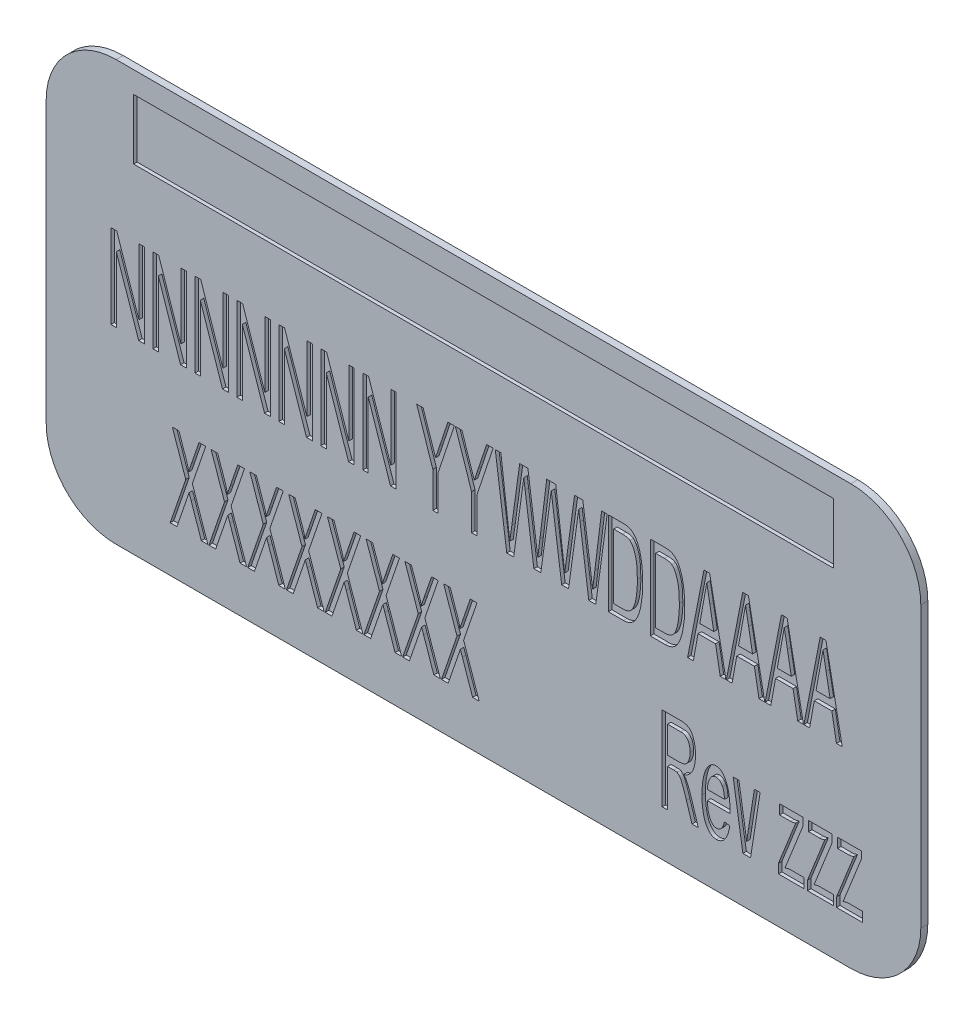
from build123d import *

# Parameters (mm, degrees)
BOSS_EXTRU_1_DEPTH      = 0.2
ENL_V_MAT_EXTRU_1_DEPTH = 0.1
ENL_V_MAT_EXTRU_2_DEPTH = 0.1
ESQUISSE10_W            = 20
ESQUISSE10_H            = 1.725075407
ENL_V_MAT_EXTRU_3_DEPTH = 0.1


with BuildPart() as part:
    # Esquisse1 → Boss.-Extru.1 (new body)
    with BuildSketch(Plane.XY):
        with BuildLine():
            Line((-21.848822837, 2.338176796), (-0.848822837, 2.338176796))
            ThreePointArc((-0.848822837, 2.338176796), (0.565390725, 1.752390358), (1.151177163, 0.338176796))
            Line((1.151177163, 0.338176796), (1.151177163, -7.661823204))
            ThreePointArc((1.151177163, -7.661823204), (0.565390725, -9.076036767), (-0.848822837, -9.661823204))
            Line((-0.848822837, -9.661823204), (-21.848822837, -9.661823204))
            ThreePointArc((-21.848822837, -9.661823204), (-23.263036399, -9.076036767), (-23.848822837, -7.661823204))
            Line((-23.848822837, -7.661823204), (-23.848822837, 0.338176796))
            ThreePointArc((-23.848822837, 0.338176796), (-23.263036399, 1.752390358), (-21.848822837, 2.338176796))
        make_face()
    extrude(amount=BOSS_EXTRU_1_DEPTH)

    # Esquisse2 → Enlèv. mat.-Extru.1 (cut)
    # profile 1 of 17: a face of its own
    with BuildSketch(Plane.XY.offset(0.2)):
        Polygon((-21.997375607, -4.2960697), (-21.997375607, -1.8960697), (-21.83295253, -1.8960697), (-21.197375607, -3.7773197), (-21.197375607, -1.8960697), (-21.043529453, -1.8960697), (-21.043529453, -4.2960697), (-21.20795253, -4.2960697), (-21.843529453, -2.415781238), (-21.843529453, -4.2960697), align=None)
    # profile 2 of 17: a face of its own
    with BuildSketch(Plane.XY.offset(0.2)):
        Polygon((-20.797375607, -4.2960697), (-20.797375607, -1.8960697), (-20.63295253, -1.8960697), (-19.997375607, -3.7773197), (-19.997375607, -1.8960697), (-19.843529453, -1.8960697), (-19.843529453, -4.2960697), (-20.00795253, -4.2960697), (-20.643529453, -2.415781238), (-20.643529453, -4.2960697), align=None)
    # profile 3 of 17: a face of its own
    with BuildSketch(Plane.XY.offset(0.2)):
        Polygon((-19.597375607, -4.2960697), (-19.597375607, -1.8960697), (-19.43295253, -1.8960697), (-18.797375607, -3.7773197), (-18.797375607, -1.8960697), (-18.643529453, -1.8960697), (-18.643529453, -4.2960697), (-18.80795253, -4.2960697), (-19.443529453, -2.415781238), (-19.443529453, -4.2960697), align=None)
    # profile 4 of 17: a face of its own
    with BuildSketch(Plane.XY.offset(0.2)):
        Polygon((-18.397375607, -4.2960697), (-18.397375607, -1.8960697), (-18.23295253, -1.8960697), (-17.597375607, -3.7773197), (-17.597375607, -1.8960697), (-17.443529453, -1.8960697), (-17.443529453, -4.2960697), (-17.60795253, -4.2960697), (-18.243529453, -2.415781238), (-18.243529453, -4.2960697), align=None)
    # profile 5 of 17: a face of its own
    with BuildSketch(Plane.XY.offset(0.2)):
        Polygon((-17.197375607, -4.2960697), (-17.197375607, -1.8960697), (-17.03295253, -1.8960697), (-16.397375607, -3.7773197), (-16.397375607, -1.8960697), (-16.243529453, -1.8960697), (-16.243529453, -4.2960697), (-16.40795253, -4.2960697), (-17.043529453, -2.415781238), (-17.043529453, -4.2960697), align=None)
    # profile 6 of 17: a face of its own
    with BuildSketch(Plane.XY.offset(0.2)):
        Polygon((-15.997375607, -4.2960697), (-15.997375607, -1.8960697), (-15.83295253, -1.8960697), (-15.197375607, -3.7773197), (-15.197375607, -1.8960697), (-15.043529453, -1.8960697), (-15.043529453, -4.2960697), (-15.20795253, -4.2960697), (-15.843529453, -2.415781238), (-15.843529453, -4.2960697), align=None)
    # profile 7 of 17: a face of its own
    with BuildSketch(Plane.XY.offset(0.2)):
        Polygon((-14.797375607, -4.2960697), (-14.797375607, -1.8960697), (-14.63295253, -1.8960697), (-13.997375607, -3.7773197), (-13.997375607, -1.8960697), (-13.843529453, -1.8960697), (-13.843529453, -4.2960697), (-14.00795253, -4.2960697), (-14.643529453, -2.415781238), (-14.643529453, -4.2960697), align=None)
    # profile 8 of 17: a face of its own
    with BuildSketch(Plane.XY.offset(0.2)):
        with BuildLine():
            Line((-12.797375607, -4.2960697), (-12.797375607, -3.279242777))
            Line((-12.797375607, -3.279242777), (-13.258914068, -1.8960697))
            Line((-13.258914068, -1.8960697), (-13.073817915, -1.8960697))
            Line((-13.073817915, -1.8960697), (-12.827664068, -2.634531238))
            add(Edge.make_bspline(
                [(-12.827664068, -2.634531238), (-12.817067101, -2.666255268), (-12.796997087, -2.726338659), (-12.768867352, -2.811567966), (-12.743009071, -2.886493789), (-12.727613049, -2.933392326), (-12.72045253, -2.955204315)],
                knots=[0, 0, 0, 0, 1.187045161, 2.248191592, 3.185253382, 4, 4, 4, 4], degree=3))
            add(Edge.make_bspline(
                [(-12.72045253, -2.955204315), (-12.717103326, -2.945102744), (-12.709974274, -2.923600726), (-12.698301361, -2.889564566), (-12.685939781, -2.85148447), (-12.672066077, -2.809793962), (-12.656454381, -2.764571995), (-12.640292101, -2.715417778), (-12.622425768, -2.662773253), (-12.610335281, -2.626365232), (-12.604106376, -2.607608161)],
                knots=[0, 0, 0, 0, 0.696802911, 1.483201767, 2.355870768, 3.318122407, 4.360029798, 5.488186892, 6.705937452, 8, 8, 8, 8], degree=3))
            Line((-12.604106376, -2.607608161), (-12.367087145, -1.8960697))
            Line((-12.367087145, -1.8960697), (-12.181990991, -1.8960697))
            Line((-12.181990991, -1.8960697), (-12.643529453, -3.279242777))
            Line((-12.643529453, -3.279242777), (-12.643529453, -4.2960697))
            Line((-12.643529453, -4.2960697), (-12.797375607, -4.2960697))
        make_face()
    # profile 9 of 17: a face of its own
    with BuildSketch(Plane.XY.offset(0.2)):
        with BuildLine():
            Line((-11.689683299, -4.2960697), (-11.689683299, -3.279242777))
            Line((-11.689683299, -3.279242777), (-12.151221761, -1.8960697))
            Line((-12.151221761, -1.8960697), (-11.966125607, -1.8960697))
            Line((-11.966125607, -1.8960697), (-11.719971761, -2.634531238))
            add(Edge.make_bspline(
                [(-11.719971761, -2.634531238), (-11.709374793, -2.666255268), (-11.68930478, -2.726338659), (-11.661175045, -2.811567966), (-11.635316764, -2.886493789), (-11.619920741, -2.933392326), (-11.612760222, -2.955204315)],
                knots=[0, 0, 0, 0, 1.187045161, 2.248191592, 3.185253382, 4, 4, 4, 4], degree=3))
            add(Edge.make_bspline(
                [(-11.612760222, -2.955204315), (-11.609411019, -2.945102744), (-11.602281966, -2.923600726), (-11.590609053, -2.889564566), (-11.578247473, -2.85148447), (-11.564373769, -2.809793962), (-11.548762073, -2.764571995), (-11.532599794, -2.715417778), (-11.51473346, -2.662773253), (-11.502642974, -2.626365232), (-11.496414068, -2.607608161)],
                knots=[0, 0, 0, 0, 0.696802911, 1.483201767, 2.355870768, 3.318122407, 4.360029798, 5.488186892, 6.705937452, 8, 8, 8, 8], degree=3))
            Line((-11.496414068, -2.607608161), (-11.259394838, -1.8960697))
            Line((-11.259394838, -1.8960697), (-11.074298684, -1.8960697))
            Line((-11.074298684, -1.8960697), (-11.535837145, -3.279242777))
            Line((-11.535837145, -3.279242777), (-11.535837145, -4.2960697))
            Line((-11.535837145, -4.2960697), (-11.689683299, -4.2960697))
        make_face()
    # profile 10 of 17: a face of its own
    with BuildSketch(Plane.XY.offset(0.2)):
        with BuildLine():
            Line((-10.684394838, -4.2960697), (-11.012760222, -1.8960697))
            Line((-11.012760222, -1.8960697), (-10.853144838, -1.8960697))
            Line((-10.853144838, -1.8960697), (-10.657471761, -3.473954315))
            add(Edge.make_bspline(
                [(-10.657471761, -3.473954315), (-10.64734577, -3.55520063), (-10.62713556, -3.717358111), (-10.607281913, -3.879559634), (-10.597375607, -3.960492777)],
                knots=[0, 0, 0, 0, 1.002066804, 2, 2, 2, 2], degree=3))
            add(Edge.make_bspline(
                [(-10.597375607, -3.960492777), (-10.59334946, -3.931008296), (-10.585757099, -3.875407539), (-10.575331413, -3.796839168), (-10.565567178, -3.728131758), (-10.557443171, -3.66915054), (-10.550742272, -3.620108005), (-10.545306797, -3.58102531), (-10.541670379, -3.551647588), (-10.53922511, -3.535329395), (-10.538240991, -3.528762007)],
                knots=[0, 0, 0, 0, 1.638949351, 3.090670897, 4.365107455, 5.461054644, 6.369771406, 7.091258957, 7.634269859, 8, 8, 8, 8], degree=3))
            Line((-10.538240991, -3.528762007), (-10.314683299, -1.8960697))
            Line((-10.314683299, -1.8960697), (-10.080067915, -1.8960697))
            Line((-10.080067915, -1.8960697), (-9.913721761, -3.110492777))
            add(Edge.make_bspline(
                [(-9.913721761, -3.110492777), (-9.903395012, -3.184201056), (-9.883014943, -3.329665999), (-9.854065415, -3.545146419), (-9.824841618, -3.754666571), (-9.806444072, -3.892535049), (-9.797375607, -3.960492777)],
                knots=[0, 0, 0, 0, 1.041039999, 2.054515778, 3.041037602, 4, 4, 4, 4], degree=3))
            add(Edge.make_bspline(
                [(-9.797375607, -3.960492777), (-9.792900857, -3.923792532), (-9.783539984, -3.847018114), (-9.768606492, -3.72666907), (-9.752165978, -3.596091717), (-9.741096244, -3.50552847), (-9.735356376, -3.4585697)],
                knots=[0, 0, 0, 0, 0.87725687, 1.835161778, 2.8774901, 4, 4, 4, 4], degree=3))
            Line((-9.735356376, -3.4585697), (-9.541606376, -1.8960697))
            Line((-9.541606376, -1.8960697), (-9.381990991, -1.8960697))
            Line((-9.381990991, -1.8960697), (-9.710356376, -4.2960697))
            Line((-9.710356376, -4.2960697), (-9.908433299, -4.2960697))
            Line((-9.908433299, -4.2960697), (-10.15795253, -2.474915854))
            add(Edge.make_bspline(
                [(-10.15795253, -2.474915854), (-10.160342745, -2.456805094), (-10.16489179, -2.422336787), (-10.171579216, -2.37329137), (-10.177935955, -2.329579239), (-10.183303599, -2.29096665), (-10.187492477, -2.257434043), (-10.191267169, -2.229057283), (-10.194833616, -2.205870674), (-10.196597195, -2.192066473), (-10.197375607, -2.185973546)],
                knots=[0, 0, 0, 0, 1.503406976, 2.861276566, 4.073641829, 5.138672782, 6.06948784, 6.854747432, 7.494505974, 8, 8, 8, 8], degree=3))
            add(Edge.make_bspline(
                [(-10.197375607, -2.185973546), (-10.201544917, -2.216101371), (-10.209439293, -2.273146869), (-10.220595945, -2.354063071), (-10.230051455, -2.42574122), (-10.236293275, -2.47043203), (-10.23920253, -2.491262007)],
                knots=[0, 0, 0, 0, 1.184456801, 2.242708451, 3.180942521, 4, 4, 4, 4], degree=3))
            Line((-10.23920253, -2.491262007), (-10.486798684, -4.2960697))
            Line((-10.486798684, -4.2960697), (-10.684394838, -4.2960697))
        make_face()
    # profile 11 of 17: a face of its own
    with BuildSketch(Plane.XY.offset(0.2)):
        with BuildLine():
            Line((-9.115164068, -4.2960697), (-9.443529453, -1.8960697))
            Line((-9.443529453, -1.8960697), (-9.283914068, -1.8960697))
            Line((-9.283914068, -1.8960697), (-9.088240991, -3.473954315))
            add(Edge.make_bspline(
                [(-9.088240991, -3.473954315), (-9.078115001, -3.55520063), (-9.057904791, -3.717358111), (-9.038051144, -3.879559634), (-9.028144838, -3.960492777)],
                knots=[0, 0, 0, 0, 1.002066804, 2, 2, 2, 2], degree=3))
            add(Edge.make_bspline(
                [(-9.028144838, -3.960492777), (-9.024118691, -3.931008296), (-9.016526329, -3.875407539), (-9.006100643, -3.796839168), (-8.996336409, -3.728131758), (-8.988212402, -3.66915054), (-8.981511503, -3.620108005), (-8.976076028, -3.58102531), (-8.972439609, -3.551647588), (-8.96999434, -3.535329395), (-8.969010222, -3.528762007)],
                knots=[0, 0, 0, 0, 1.638949351, 3.090670897, 4.365107455, 5.461054644, 6.369771406, 7.091258957, 7.634269859, 8, 8, 8, 8], degree=3))
            Line((-8.969010222, -3.528762007), (-8.74545253, -1.8960697))
            Line((-8.74545253, -1.8960697), (-8.510837145, -1.8960697))
            Line((-8.510837145, -1.8960697), (-8.344490991, -3.110492777))
            add(Edge.make_bspline(
                [(-8.344490991, -3.110492777), (-8.334164243, -3.184201056), (-8.313784174, -3.329665999), (-8.284834645, -3.545146419), (-8.255610849, -3.754666571), (-8.237213302, -3.892535049), (-8.228144838, -3.960492777)],
                knots=[0, 0, 0, 0, 1.041039999, 2.054515778, 3.041037602, 4, 4, 4, 4], degree=3))
            add(Edge.make_bspline(
                [(-8.228144838, -3.960492777), (-8.223670088, -3.923792532), (-8.214309215, -3.847018114), (-8.199375722, -3.72666907), (-8.182935208, -3.596091717), (-8.171865475, -3.50552847), (-8.166125607, -3.4585697)],
                knots=[0, 0, 0, 0, 0.87725687, 1.835161778, 2.8774901, 4, 4, 4, 4], degree=3))
            Line((-8.166125607, -3.4585697), (-7.972375607, -1.8960697))
            Line((-7.972375607, -1.8960697), (-7.812760222, -1.8960697))
            Line((-7.812760222, -1.8960697), (-8.141125607, -4.2960697))
            Line((-8.141125607, -4.2960697), (-8.33920253, -4.2960697))
            Line((-8.33920253, -4.2960697), (-8.588721761, -2.474915854))
            add(Edge.make_bspline(
                [(-8.588721761, -2.474915854), (-8.591111976, -2.456805094), (-8.595661021, -2.422336787), (-8.602348446, -2.37329137), (-8.608705186, -2.329579239), (-8.61407283, -2.29096665), (-8.618261708, -2.257434043), (-8.6220364, -2.229057283), (-8.625602847, -2.205870674), (-8.627366425, -2.192066473), (-8.628144838, -2.185973546)],
                knots=[0, 0, 0, 0, 1.503406976, 2.861276566, 4.073641829, 5.138672782, 6.06948784, 6.854747432, 7.494505974, 8, 8, 8, 8], degree=3))
            add(Edge.make_bspline(
                [(-8.628144838, -2.185973546), (-8.632314148, -2.216101371), (-8.640208523, -2.273146869), (-8.651365176, -2.354063071), (-8.660820686, -2.42574122), (-8.667062506, -2.47043203), (-8.669971761, -2.491262007)],
                knots=[0, 0, 0, 0, 1.184456801, 2.242708451, 3.180942521, 4, 4, 4, 4], degree=3))
            Line((-8.669971761, -2.491262007), (-8.917567915, -4.2960697))
            Line((-8.917567915, -4.2960697), (-9.115164068, -4.2960697))
        make_face()
    # profile 12 of 17: a face of its own
    with BuildSketch(Plane.XY.offset(0.2)):
        with BuildLine():
            Line((-7.781990991, -4.2960697), (-7.781990991, -1.8960697))
            Line((-7.781990991, -1.8960697), (-7.371894838, -1.8960697))
            add(Edge.make_bspline(
                [(-7.371894838, -1.8960697), (-7.350069147, -1.896272053), (-7.30902258, -1.89665261), (-7.25185344, -1.90372178), (-7.202192317, -1.913210612), (-7.173360356, -1.925116625), (-7.159875607, -1.930685084)],
                knots=[0, 0, 0, 0, 1.209218742, 2.274121739, 3.192804279, 4, 4, 4, 4], degree=3))
            add(Edge.make_bspline(
                [(-7.159875607, -1.930685084), (-7.1429887, -1.939553597), (-7.108524287, -1.957653304), (-7.062559089, -1.99699691), (-7.020469971, -2.04542114), (-6.997032248, -2.082886978), (-6.984875607, -2.1023197)],
                knots=[0, 0, 0, 0, 0.917248745, 1.872008839, 2.896256901, 4, 4, 4, 4], degree=3))
            add(Edge.make_bspline(
                [(-6.984875607, -2.1023197), (-6.969512609, -2.130712462), (-6.937663802, -2.189573081), (-6.900374035, -2.287459236), (-6.86834118, -2.395819561), (-6.842091141, -2.515043085), (-6.822557043, -2.644234502), (-6.80745918, -2.782469394), (-6.798962305, -2.92977629), (-6.797914749, -3.030995025), (-6.797375607, -3.08308893)],
                knots=[0, 0, 0, 0, 0.767236926, 1.590547629, 2.485512821, 3.453908061, 4.491812888, 5.592276963, 6.760825303, 8, 8, 8, 8], degree=3))
            add(Edge.make_bspline(
                [(-6.797375607, -3.08308893), (-6.797734491, -3.127325518), (-6.798431779, -3.213274234), (-6.804101816, -3.338375127), (-6.814120268, -3.455772153), (-6.828056545, -3.565114852), (-6.844761439, -3.665988029), (-6.863863141, -3.758098618), (-6.885292506, -3.841073982), (-6.908774243, -3.915291549), (-6.934587797, -3.980856525), (-6.960532503, -4.039332869), (-6.988754761, -4.090049996), (-7.017325855, -4.134479041), (-7.048962859, -4.172386037), (-7.082910352, -4.20529648), (-7.120528117, -4.23276087), (-7.160522679, -4.256351706), (-7.204212878, -4.273917856), (-7.250740589, -4.287094084), (-7.300480146, -4.294858602), (-7.334688136, -4.295659892), (-7.352183299, -4.2960697)],
                knots=[0, 0, 0, 0, 1.800094546, 3.497462691, 5.094565961, 6.593423588, 7.981807382, 9.254415828, 10.420159978, 11.4678544, 12.419732639, 13.286514356, 14.068783023, 14.77961528, 15.432569631, 16.073692928, 16.698454999, 17.323727399, 17.958316615, 18.608660443, 19.28842027, 20, 20, 20, 20], degree=3))
            Line((-7.352183299, -4.2960697), (-7.781990991, -4.2960697))
        make_face()
        with BuildLine():
            Line((-7.628144838, -4.019146623), (-7.369010222, -4.019146623))
            add(Edge.make_bspline(
                [(-7.369010222, -4.019146623), (-7.350070326, -4.018612707), (-7.31423792, -4.017602591), (-7.263549605, -4.009607202), (-7.219262298, -3.995742153), (-7.180760123, -3.976354059), (-7.148017238, -3.950779936), (-7.118601781, -3.921541031), (-7.092801506, -3.887480237), (-7.078956833, -3.862286232), (-7.071894838, -3.849435084)],
                knots=[0, 0, 0, 0, 1.249650705, 2.364215218, 3.374377069, 4.301504878, 5.192076899, 6.104488424, 7.03312322, 8, 8, 8, 8], degree=3))
            add(Edge.make_bspline(
                [(-7.071894838, -3.849435084), (-7.062507897, -3.82892486), (-7.042651381, -3.785538884), (-7.01994002, -3.713252216), (-6.999179296, -3.631927373), (-6.982119415, -3.540529515), (-6.968308134, -3.439296282), (-6.95846237, -3.327796821), (-6.952077435, -3.206240683), (-6.951514351, -3.121719502), (-6.951221761, -3.077800469)],
                knots=[0, 0, 0, 0, 0.687444329, 1.454174466, 2.306617836, 3.247115966, 4.288242282, 5.422094717, 6.6604647, 8, 8, 8, 8], degree=3))
            add(Edge.make_bspline(
                [(-6.951221761, -3.077800469), (-6.951396663, -3.047189318), (-6.951736478, -2.987715521), (-6.954632478, -2.901146476), (-6.959411483, -2.820031756), (-6.965782424, -2.744446197), (-6.975329987, -2.674467518), (-6.985306014, -2.609670497), (-6.998482148, -2.550557708), (-7.012925305, -2.496654269), (-7.028826796, -2.447614193), (-7.045580352, -2.402816981), (-7.063238842, -2.362278093), (-7.082187372, -2.326169336), (-7.101128545, -2.293725891), (-7.121394006, -2.26571803), (-7.142396901, -2.241686011), (-7.158097617, -2.228736664), (-7.165644838, -2.222512007)],
                knots=[0, 0, 0, 0, 1.624486671, 3.156182828, 4.595991041, 5.936527029, 7.180250294, 8.343530302, 9.414514798, 10.39240733, 11.304157138, 12.14925215, 12.929879803, 13.64881622, 14.312455318, 14.921477323, 15.481561996, 16, 16, 16, 16], degree=3))
            add(Edge.make_bspline(
                [(-7.165644838, -2.222512007), (-7.177703233, -2.214711662), (-7.203700334, -2.197894634), (-7.252244455, -2.183930835), (-7.309445517, -2.173946744), (-7.350999189, -2.173326305), (-7.373337145, -2.172992777)],
                knots=[0, 0, 0, 0, 0.790842195, 1.705003453, 2.766281536, 4, 4, 4, 4], degree=3))
            Line((-7.373337145, -2.172992777), (-7.628144838, -2.172992777))
            Line((-7.628144838, -2.172992777), (-7.628144838, -4.019146623))
        make_face(mode=Mode.SUBTRACT)
    # profile 13 of 17: a face of its own
    with BuildSketch(Plane.XY.offset(0.2)):
        with BuildLine():
            Line((-6.581990991, -4.2960697), (-6.581990991, -1.8960697))
            Line((-6.581990991, -1.8960697), (-6.171894838, -1.8960697))
            add(Edge.make_bspline(
                [(-6.171894838, -1.8960697), (-6.150069147, -1.896272053), (-6.10902258, -1.89665261), (-6.05185344, -1.90372178), (-6.002192317, -1.913210612), (-5.973360356, -1.925116625), (-5.959875607, -1.930685084)],
                knots=[0, 0, 0, 0, 1.209218742, 2.274121739, 3.192804279, 4, 4, 4, 4], degree=3))
            add(Edge.make_bspline(
                [(-5.959875607, -1.930685084), (-5.9429887, -1.939553597), (-5.908524287, -1.957653304), (-5.862559089, -1.99699691), (-5.820469971, -2.04542114), (-5.797032248, -2.082886978), (-5.784875607, -2.1023197)],
                knots=[0, 0, 0, 0, 0.917248745, 1.872008839, 2.896256901, 4, 4, 4, 4], degree=3))
            add(Edge.make_bspline(
                [(-5.784875607, -2.1023197), (-5.769512609, -2.130712462), (-5.737663802, -2.189573081), (-5.700374035, -2.287459236), (-5.66834118, -2.395819561), (-5.642091141, -2.515043085), (-5.622557043, -2.644234502), (-5.60745918, -2.782469394), (-5.598962305, -2.92977629), (-5.597914749, -3.030995025), (-5.597375607, -3.08308893)],
                knots=[0, 0, 0, 0, 0.767236926, 1.590547629, 2.485512821, 3.453908061, 4.491812888, 5.592276963, 6.760825303, 8, 8, 8, 8], degree=3))
            add(Edge.make_bspline(
                [(-5.597375607, -3.08308893), (-5.597734491, -3.127325518), (-5.598431779, -3.213274234), (-5.604101816, -3.338375127), (-5.614120268, -3.455772153), (-5.628056545, -3.565114852), (-5.644761439, -3.665988029), (-5.663863141, -3.758098618), (-5.685292506, -3.841073982), (-5.708774243, -3.915291549), (-5.734587797, -3.980856525), (-5.760532503, -4.039332869), (-5.788754761, -4.090049996), (-5.817325855, -4.134479041), (-5.848962859, -4.172386037), (-5.882910352, -4.20529648), (-5.920528117, -4.23276087), (-5.960522679, -4.256351706), (-6.004212878, -4.273917856), (-6.050740589, -4.287094084), (-6.100480146, -4.294858602), (-6.134688136, -4.295659892), (-6.152183299, -4.2960697)],
                knots=[0, 0, 0, 0, 1.800094546, 3.497462691, 5.094565961, 6.593423588, 7.981807382, 9.254415828, 10.420159978, 11.4678544, 12.419732639, 13.286514356, 14.068783023, 14.77961528, 15.432569631, 16.073692928, 16.698454999, 17.323727399, 17.958316615, 18.608660443, 19.28842027, 20, 20, 20, 20], degree=3))
            Line((-6.152183299, -4.2960697), (-6.581990991, -4.2960697))
        make_face()
        with BuildLine():
            Line((-6.428144838, -4.019146623), (-6.169010222, -4.019146623))
            add(Edge.make_bspline(
                [(-6.169010222, -4.019146623), (-6.150070326, -4.018612707), (-6.11423792, -4.017602591), (-6.063549605, -4.009607202), (-6.019262298, -3.995742153), (-5.980760123, -3.976354059), (-5.948017238, -3.950779936), (-5.918601781, -3.921541031), (-5.892801506, -3.887480237), (-5.878956833, -3.862286232), (-5.871894838, -3.849435084)],
                knots=[0, 0, 0, 0, 1.249650705, 2.364215218, 3.374377069, 4.301504878, 5.192076899, 6.104488424, 7.03312322, 8, 8, 8, 8], degree=3))
            add(Edge.make_bspline(
                [(-5.871894838, -3.849435084), (-5.862507897, -3.82892486), (-5.842651381, -3.785538884), (-5.81994002, -3.713252216), (-5.799179296, -3.631927373), (-5.782119415, -3.540529515), (-5.768308134, -3.439296282), (-5.75846237, -3.327796821), (-5.752077435, -3.206240683), (-5.751514351, -3.121719502), (-5.751221761, -3.077800469)],
                knots=[0, 0, 0, 0, 0.687444329, 1.454174466, 2.306617836, 3.247115966, 4.288242282, 5.422094717, 6.6604647, 8, 8, 8, 8], degree=3))
            add(Edge.make_bspline(
                [(-5.751221761, -3.077800469), (-5.751396663, -3.047189318), (-5.751736478, -2.987715521), (-5.754632478, -2.901146476), (-5.759411483, -2.820031756), (-5.765782424, -2.744446197), (-5.775329987, -2.674467518), (-5.785306014, -2.609670497), (-5.798482148, -2.550557708), (-5.812925305, -2.496654269), (-5.828826796, -2.447614193), (-5.845580352, -2.402816981), (-5.863238842, -2.362278093), (-5.882187372, -2.326169336), (-5.901128545, -2.293725891), (-5.921394006, -2.26571803), (-5.942396901, -2.241686011), (-5.958097617, -2.228736664), (-5.965644838, -2.222512007)],
                knots=[0, 0, 0, 0, 1.624486671, 3.156182828, 4.595991041, 5.936527029, 7.180250294, 8.343530302, 9.414514798, 10.39240733, 11.304157138, 12.14925215, 12.929879803, 13.64881622, 14.312455318, 14.921477323, 15.481561996, 16, 16, 16, 16], degree=3))
            add(Edge.make_bspline(
                [(-5.965644838, -2.222512007), (-5.977703233, -2.214711662), (-6.003700334, -2.197894634), (-6.052244455, -2.183930835), (-6.109445517, -2.173946744), (-6.150999189, -2.173326305), (-6.173337145, -2.172992777)],
                knots=[0, 0, 0, 0, 0.790842195, 1.705003453, 2.766281536, 4, 4, 4, 4], degree=3))
            Line((-6.173337145, -2.172992777), (-6.428144838, -2.172992777))
            Line((-6.428144838, -2.172992777), (-6.428144838, -4.019146623))
        make_face(mode=Mode.SUBTRACT)
    # profile 14 of 17: a face of its own
    with BuildSketch(Plane.XY.offset(0.2)):
        Polygon((-5.514683299, -4.2960697), (-5.048337145, -1.8960697), (-4.884875607, -1.8960697), (-4.418529453, -4.2960697), (-4.581990991, -4.2960697), (-4.715644838, -3.557608161), (-5.217087145, -3.557608161), (-5.351221761, -4.2960697), align=None)
        with BuildLine():
            Line((-5.167087145, -3.280685084), (-4.766125607, -3.280685084))
            Line((-4.766125607, -3.280685084), (-4.878625607, -2.659531238))
            add(Edge.make_bspline(
                [(-4.878625607, -2.659531238), (-4.883146751, -2.63501815), (-4.891949862, -2.587288759), (-4.904237011, -2.517509795), (-4.916598193, -2.451414092), (-4.927291481, -2.388820304), (-4.938108839, -2.329728617), (-4.948017641, -2.274245704), (-4.957796779, -2.222381837), (-4.963747036, -2.189023033), (-4.966606376, -2.172992777)],
                knots=[0, 0, 0, 0, 1.209945762, 2.355883214, 3.439198162, 4.473827899, 5.438166865, 6.355192696, 7.209603446, 8, 8, 8, 8], degree=3))
            add(Edge.make_bspline(
                [(-4.966606376, -2.172992777), (-4.979872677, -2.246877314), (-5.006582583, -2.395633853), (-5.03371789, -2.544313382), (-5.047375607, -2.619146623)],
                knots=[0, 0, 0, 0, 0.993361883, 2, 2, 2, 2], degree=3))
            Line((-5.047375607, -2.619146623), (-5.167087145, -3.280685084))
        make_face(mode=Mode.SUBTRACT)
    # profile 15 of 17: a face of its own
    with BuildSketch(Plane.XY.offset(0.2)):
        Polygon((-4.406990991, -4.2960697), (-3.940644838, -1.8960697), (-3.777183299, -1.8960697), (-3.310837145, -4.2960697), (-3.474298684, -4.2960697), (-3.60795253, -3.557608161), (-4.109394838, -3.557608161), (-4.243529453, -4.2960697), align=None)
        with BuildLine():
            Line((-4.059394838, -3.280685084), (-3.658433299, -3.280685084))
            Line((-3.658433299, -3.280685084), (-3.770933299, -2.659531238))
            add(Edge.make_bspline(
                [(-3.770933299, -2.659531238), (-3.775454443, -2.63501815), (-3.784257555, -2.587288759), (-3.796544703, -2.517509795), (-3.808905885, -2.451414092), (-3.819599173, -2.388820304), (-3.830416532, -2.329728617), (-3.840325334, -2.274245704), (-3.850104472, -2.222381837), (-3.856054729, -2.189023033), (-3.858914068, -2.172992777)],
                knots=[0, 0, 0, 0, 1.209945762, 2.355883214, 3.439198162, 4.473827899, 5.438166865, 6.355192696, 7.209603446, 8, 8, 8, 8], degree=3))
            add(Edge.make_bspline(
                [(-3.858914068, -2.172992777), (-3.872180369, -2.246877314), (-3.898890275, -2.395633853), (-3.926025582, -2.544313382), (-3.939683299, -2.619146623)],
                knots=[0, 0, 0, 0, 0.993361883, 2, 2, 2, 2], degree=3))
            Line((-3.939683299, -2.619146623), (-4.059394838, -3.280685084))
        make_face(mode=Mode.SUBTRACT)
    # profile 16 of 17: a face of its own
    with BuildSketch(Plane.XY.offset(0.2)):
        Polygon((-3.299298684, -4.2960697), (-2.83295253, -1.8960697), (-2.669490991, -1.8960697), (-2.203144838, -4.2960697), (-2.366606376, -4.2960697), (-2.500260222, -3.557608161), (-3.00170253, -3.557608161), (-3.135837145, -4.2960697), align=None)
        with BuildLine():
            Line((-2.95170253, -3.280685084), (-2.550740991, -3.280685084))
            Line((-2.550740991, -3.280685084), (-2.663240991, -2.659531238))
            add(Edge.make_bspline(
                [(-2.663240991, -2.659531238), (-2.667762136, -2.63501815), (-2.676565247, -2.587288759), (-2.688852395, -2.517509795), (-2.701213578, -2.451414092), (-2.711906865, -2.388820304), (-2.722724224, -2.329728617), (-2.732633026, -2.274245704), (-2.742412164, -2.222381837), (-2.748362421, -2.189023033), (-2.751221761, -2.172992777)],
                knots=[0, 0, 0, 0, 1.209945762, 2.355883214, 3.439198162, 4.473827899, 5.438166865, 6.355192696, 7.209603446, 8, 8, 8, 8], degree=3))
            add(Edge.make_bspline(
                [(-2.751221761, -2.172992777), (-2.764488062, -2.246877314), (-2.791197967, -2.395633853), (-2.818333274, -2.544313382), (-2.831990991, -2.619146623)],
                knots=[0, 0, 0, 0, 0.993361883, 2, 2, 2, 2], degree=3))
            Line((-2.831990991, -2.619146623), (-2.95170253, -3.280685084))
        make_face(mode=Mode.SUBTRACT)
    # profile 17 of 17: a face of its own
    with BuildSketch(Plane.XY.offset(0.2)):
        Polygon((-2.191606376, -4.2960697), (-1.725260222, -1.8960697), (-1.561798684, -1.8960697), (-1.09545253, -4.2960697), (-1.258914068, -4.2960697), (-1.392567915, -3.557608161), (-1.894010222, -3.557608161), (-2.028144838, -4.2960697), align=None)
        with BuildLine():
            Line((-1.844010222, -3.280685084), (-1.443048684, -3.280685084))
            Line((-1.443048684, -3.280685084), (-1.555548684, -2.659531238))
            add(Edge.make_bspline(
                [(-1.555548684, -2.659531238), (-1.560069828, -2.63501815), (-1.568872939, -2.587288759), (-1.581160088, -2.517509795), (-1.59352127, -2.451414092), (-1.604214558, -2.388820304), (-1.615031916, -2.329728617), (-1.624940718, -2.274245704), (-1.634719856, -2.222381837), (-1.640670113, -2.189023033), (-1.643529453, -2.172992777)],
                knots=[0, 0, 0, 0, 1.209945762, 2.355883214, 3.439198162, 4.473827899, 5.438166865, 6.355192696, 7.209603446, 8, 8, 8, 8], degree=3))
            add(Edge.make_bspline(
                [(-1.643529453, -2.172992777), (-1.656795754, -2.246877314), (-1.68350566, -2.395633853), (-1.710640967, -2.544313382), (-1.724298684, -2.619146623)],
                knots=[0, 0, 0, 0, 0.993361883, 2, 2, 2, 2], degree=3))
            Line((-1.724298684, -2.619146623), (-1.844010222, -3.280685084))
        make_face(mode=Mode.SUBTRACT)
    extrude(amount=-ENL_V_MAT_EXTRU_1_DEPTH, mode=Mode.SUBTRACT)

    # Esquisse8 → Enlèv. mat.-Extru.2 (cut)
    # profile 1 of 14: a face of its own
    with BuildSketch(Plane.XY.offset(0.2)):
        with BuildLine():
            Line((-20.304250109, -8.356300295), (-19.860500109, -7.063511833))
            Line((-19.860500109, -7.063511833), (-20.242711648, -5.956300295))
            Line((-20.242711648, -5.956300295), (-20.055211648, -5.956300295))
            Line((-20.055211648, -5.956300295), (-19.837423186, -6.587069525))
            add(Edge.make_bspline(
                [(-19.837423186, -6.587069525), (-19.832433738, -6.60228607), (-19.82289605, -6.63137359), (-19.809613489, -6.673030679), (-19.799598971, -6.711108998), (-19.791746444, -6.745241203), (-19.786462029, -6.775409745), (-19.78316076, -6.801720566), (-19.783068459, -6.824319305), (-19.784739943, -6.838040751), (-19.785500109, -6.844281064)],
                knots=[0, 0, 0, 0, 1.453428248, 2.778332613, 3.967248284, 5.025801759, 5.955965637, 6.746200148, 7.429790105, 8, 8, 8, 8], degree=3))
            add(Edge.make_bspline(
                [(-19.785500109, -6.844281064), (-19.778879034, -6.825388158), (-19.765151268, -6.786216672), (-19.744858883, -6.725078534), (-19.721863247, -6.660046763), (-19.706455789, -6.615127472), (-19.698480879, -6.591877218)],
                knots=[0, 0, 0, 0, 0.899792049, 1.865578155, 2.895221838, 4, 4, 4, 4], degree=3))
            Line((-19.698480879, -6.591877218), (-19.480692417, -5.956300295))
            Line((-19.480692417, -5.956300295), (-19.288865494, -5.956300295))
            Line((-19.288865494, -5.956300295), (-19.671077033, -7.070242602))
            Line((-19.671077033, -7.070242602), (-19.227327033, -8.356300295))
            Line((-19.227327033, -8.356300295), (-19.414827033, -8.356300295))
            Line((-19.414827033, -8.356300295), (-19.706173186, -7.509665679))
            add(Edge.make_bspline(
                [(-19.706173186, -7.509665679), (-19.715326934, -7.483390245), (-19.734851235, -7.42734659), (-19.75411441, -7.371212633), (-19.764346263, -7.341396449)],
                knots=[0, 0, 0, 0, 0.937677431, 2, 2, 2, 2], degree=3))
            add(Edge.make_bspline(
                [(-19.764346263, -7.341396449), (-19.771285038, -7.361572474), (-19.783942824, -7.398377791), (-19.800533609, -7.448728435), (-19.81462384, -7.488310979), (-19.822536082, -7.511422721), (-19.825884725, -7.521204141)],
                knots=[0, 0, 0, 0, 1.347179553, 2.45753912, 3.347195111, 4, 4, 4, 4], degree=3))
            Line((-19.825884725, -7.521204141), (-20.112423186, -8.356300295))
            Line((-20.112423186, -8.356300295), (-20.304250109, -8.356300295))
        make_face()
    # profile 2 of 14: a face of its own
    with BuildSketch(Plane.XY.offset(0.2)):
        with BuildLine():
            Line((-19.196557802, -8.356300295), (-18.752807802, -7.063511833))
            Line((-18.752807802, -7.063511833), (-19.13501934, -5.956300295))
            Line((-19.13501934, -5.956300295), (-18.94751934, -5.956300295))
            Line((-18.94751934, -5.956300295), (-18.729730879, -6.587069525))
            add(Edge.make_bspline(
                [(-18.729730879, -6.587069525), (-18.724741431, -6.60228607), (-18.715203742, -6.63137359), (-18.701921182, -6.673030679), (-18.691906664, -6.711108998), (-18.684054137, -6.745241203), (-18.678769721, -6.775409745), (-18.675468452, -6.801720566), (-18.675376151, -6.824319305), (-18.677047635, -6.838040751), (-18.677807802, -6.844281064)],
                knots=[0, 0, 0, 0, 1.453428248, 2.778332613, 3.967248284, 5.025801759, 5.955965637, 6.746200148, 7.429790105, 8, 8, 8, 8], degree=3))
            add(Edge.make_bspline(
                [(-18.677807802, -6.844281064), (-18.671186726, -6.825388158), (-18.65745896, -6.786216672), (-18.637166575, -6.725078534), (-18.614170939, -6.660046763), (-18.598763481, -6.615127472), (-18.590788571, -6.591877218)],
                knots=[0, 0, 0, 0, 0.899792049, 1.865578155, 2.895221838, 4, 4, 4, 4], degree=3))
            Line((-18.590788571, -6.591877218), (-18.373000109, -5.956300295))
            Line((-18.373000109, -5.956300295), (-18.181173186, -5.956300295))
            Line((-18.181173186, -5.956300295), (-18.563384725, -7.070242602))
            Line((-18.563384725, -7.070242602), (-18.119634725, -8.356300295))
            Line((-18.119634725, -8.356300295), (-18.307134725, -8.356300295))
            Line((-18.307134725, -8.356300295), (-18.598480879, -7.509665679))
            add(Edge.make_bspline(
                [(-18.598480879, -7.509665679), (-18.607634627, -7.483390245), (-18.627158927, -7.42734659), (-18.646422103, -7.371212633), (-18.656653956, -7.341396449)],
                knots=[0, 0, 0, 0, 0.937677431, 2, 2, 2, 2], degree=3))
            add(Edge.make_bspline(
                [(-18.656653956, -7.341396449), (-18.66359273, -7.361572474), (-18.676250516, -7.398377791), (-18.692841302, -7.448728435), (-18.706931533, -7.488310979), (-18.714843775, -7.511422721), (-18.718192417, -7.521204141)],
                knots=[0, 0, 0, 0, 1.347179553, 2.45753912, 3.347195111, 4, 4, 4, 4], degree=3))
            Line((-18.718192417, -7.521204141), (-19.004730879, -8.356300295))
            Line((-19.004730879, -8.356300295), (-19.196557802, -8.356300295))
        make_face()
    # profile 3 of 14: a face of its own
    with BuildSketch(Plane.XY.offset(0.2)):
        with BuildLine():
            Line((-18.088865494, -8.356300295), (-17.645115494, -7.063511833))
            Line((-17.645115494, -7.063511833), (-18.027327033, -5.956300295))
            Line((-18.027327033, -5.956300295), (-17.839827033, -5.956300295))
            Line((-17.839827033, -5.956300295), (-17.622038571, -6.587069525))
            add(Edge.make_bspline(
                [(-17.622038571, -6.587069525), (-17.617049123, -6.60228607), (-17.607511434, -6.63137359), (-17.594228874, -6.673030679), (-17.584214356, -6.711108998), (-17.576361829, -6.745241203), (-17.571077413, -6.775409745), (-17.567776144, -6.801720566), (-17.567683844, -6.824319305), (-17.569355327, -6.838040751), (-17.570115494, -6.844281064)],
                knots=[0, 0, 0, 0, 1.453428248, 2.778332613, 3.967248284, 5.025801759, 5.955965637, 6.746200148, 7.429790105, 8, 8, 8, 8], degree=3))
            add(Edge.make_bspline(
                [(-17.570115494, -6.844281064), (-17.563494418, -6.825388158), (-17.549766653, -6.786216672), (-17.529474268, -6.725078534), (-17.506478632, -6.660046763), (-17.491071174, -6.615127472), (-17.483096263, -6.591877218)],
                knots=[0, 0, 0, 0, 0.899792049, 1.865578155, 2.895221838, 4, 4, 4, 4], degree=3))
            Line((-17.483096263, -6.591877218), (-17.265307802, -5.956300295))
            Line((-17.265307802, -5.956300295), (-17.073480879, -5.956300295))
            Line((-17.073480879, -5.956300295), (-17.455692417, -7.070242602))
            Line((-17.455692417, -7.070242602), (-17.011942417, -8.356300295))
            Line((-17.011942417, -8.356300295), (-17.199442417, -8.356300295))
            Line((-17.199442417, -8.356300295), (-17.490788571, -7.509665679))
            add(Edge.make_bspline(
                [(-17.490788571, -7.509665679), (-17.499942319, -7.483390245), (-17.51946662, -7.42734659), (-17.538729795, -7.371212633), (-17.548961648, -7.341396449)],
                knots=[0, 0, 0, 0, 0.937677431, 2, 2, 2, 2], degree=3))
            add(Edge.make_bspline(
                [(-17.548961648, -7.341396449), (-17.555900423, -7.361572474), (-17.568558208, -7.398377791), (-17.585148994, -7.448728435), (-17.599239225, -7.488310979), (-17.607151467, -7.511422721), (-17.610500109, -7.521204141)],
                knots=[0, 0, 0, 0, 1.347179553, 2.45753912, 3.347195111, 4, 4, 4, 4], degree=3))
            Line((-17.610500109, -7.521204141), (-17.897038571, -8.356300295))
            Line((-17.897038571, -8.356300295), (-18.088865494, -8.356300295))
        make_face()
    # profile 4 of 14: a face of its own
    with BuildSketch(Plane.XY.offset(0.2)):
        with BuildLine():
            Line((-16.981173186, -8.356300295), (-16.537423186, -7.063511833))
            Line((-16.537423186, -7.063511833), (-16.919634725, -5.956300295))
            Line((-16.919634725, -5.956300295), (-16.732134725, -5.956300295))
            Line((-16.732134725, -5.956300295), (-16.514346263, -6.587069525))
            add(Edge.make_bspline(
                [(-16.514346263, -6.587069525), (-16.509356815, -6.60228607), (-16.499819127, -6.63137359), (-16.486536566, -6.673030679), (-16.476522048, -6.711108998), (-16.468669521, -6.745241203), (-16.463385106, -6.775409745), (-16.460083837, -6.801720566), (-16.459991536, -6.824319305), (-16.46166302, -6.838040751), (-16.462423186, -6.844281064)],
                knots=[0, 0, 0, 0, 1.453428248, 2.778332613, 3.967248284, 5.025801759, 5.955965637, 6.746200148, 7.429790105, 8, 8, 8, 8], degree=3))
            add(Edge.make_bspline(
                [(-16.462423186, -6.844281064), (-16.455802111, -6.825388158), (-16.442074345, -6.786216672), (-16.42178196, -6.725078534), (-16.398786324, -6.660046763), (-16.383378866, -6.615127472), (-16.375403956, -6.591877218)],
                knots=[0, 0, 0, 0, 0.899792049, 1.865578155, 2.895221838, 4, 4, 4, 4], degree=3))
            Line((-16.375403956, -6.591877218), (-16.157615494, -5.956300295))
            Line((-16.157615494, -5.956300295), (-15.965788571, -5.956300295))
            Line((-15.965788571, -5.956300295), (-16.348000109, -7.070242602))
            Line((-16.348000109, -7.070242602), (-15.904250109, -8.356300295))
            Line((-15.904250109, -8.356300295), (-16.091750109, -8.356300295))
            Line((-16.091750109, -8.356300295), (-16.383096263, -7.509665679))
            add(Edge.make_bspline(
                [(-16.383096263, -7.509665679), (-16.392250011, -7.483390245), (-16.411774312, -7.42734659), (-16.431037487, -7.371212633), (-16.44126934, -7.341396449)],
                knots=[0, 0, 0, 0, 0.937677431, 2, 2, 2, 2], degree=3))
            add(Edge.make_bspline(
                [(-16.44126934, -7.341396449), (-16.448208115, -7.361572474), (-16.460865901, -7.398377791), (-16.477456686, -7.448728435), (-16.491546917, -7.488310979), (-16.499459159, -7.511422721), (-16.502807802, -7.521204141)],
                knots=[0, 0, 0, 0, 1.347179553, 2.45753912, 3.347195111, 4, 4, 4, 4], degree=3))
            Line((-16.502807802, -7.521204141), (-16.789346263, -8.356300295))
            Line((-16.789346263, -8.356300295), (-16.981173186, -8.356300295))
        make_face()
    # profile 5 of 14: a face of its own
    with BuildSketch(Plane.XY.offset(0.2)):
        with BuildLine():
            Line((-15.873480879, -8.356300295), (-15.429730879, -7.063511833))
            Line((-15.429730879, -7.063511833), (-15.811942417, -5.956300295))
            Line((-15.811942417, -5.956300295), (-15.624442417, -5.956300295))
            Line((-15.624442417, -5.956300295), (-15.406653956, -6.587069525))
            add(Edge.make_bspline(
                [(-15.406653956, -6.587069525), (-15.401664508, -6.60228607), (-15.392126819, -6.63137359), (-15.378844259, -6.673030679), (-15.368829741, -6.711108998), (-15.360977213, -6.745241203), (-15.355692798, -6.775409745), (-15.352391529, -6.801720566), (-15.352299228, -6.824319305), (-15.353970712, -6.838040751), (-15.354730879, -6.844281064)],
                knots=[0, 0, 0, 0, 1.453428248, 2.778332613, 3.967248284, 5.025801759, 5.955965637, 6.746200148, 7.429790105, 8, 8, 8, 8], degree=3))
            add(Edge.make_bspline(
                [(-15.354730879, -6.844281064), (-15.348109803, -6.825388158), (-15.334382037, -6.786216672), (-15.314089652, -6.725078534), (-15.291094016, -6.660046763), (-15.275686558, -6.615127472), (-15.267711648, -6.591877218)],
                knots=[0, 0, 0, 0, 0.899792049, 1.865578155, 2.895221838, 4, 4, 4, 4], degree=3))
            Line((-15.267711648, -6.591877218), (-15.049923186, -5.956300295))
            Line((-15.049923186, -5.956300295), (-14.858096263, -5.956300295))
            Line((-14.858096263, -5.956300295), (-15.240307802, -7.070242602))
            Line((-15.240307802, -7.070242602), (-14.796557802, -8.356300295))
            Line((-14.796557802, -8.356300295), (-14.984057802, -8.356300295))
            Line((-14.984057802, -8.356300295), (-15.275403956, -7.509665679))
            add(Edge.make_bspline(
                [(-15.275403956, -7.509665679), (-15.284557704, -7.483390245), (-15.304082004, -7.42734659), (-15.32334518, -7.371212633), (-15.333577033, -7.341396449)],
                knots=[0, 0, 0, 0, 0.937677431, 2, 2, 2, 2], degree=3))
            add(Edge.make_bspline(
                [(-15.333577033, -7.341396449), (-15.340515807, -7.361572474), (-15.353173593, -7.398377791), (-15.369764379, -7.448728435), (-15.38385461, -7.488310979), (-15.391766851, -7.511422721), (-15.395115494, -7.521204141)],
                knots=[0, 0, 0, 0, 1.347179553, 2.45753912, 3.347195111, 4, 4, 4, 4], degree=3))
            Line((-15.395115494, -7.521204141), (-15.681653956, -8.356300295))
            Line((-15.681653956, -8.356300295), (-15.873480879, -8.356300295))
        make_face()
    # profile 6 of 14: a face of its own
    with BuildSketch(Plane.XY.offset(0.2)):
        with BuildLine():
            Line((-14.765788571, -8.356300295), (-14.322038571, -7.063511833))
            Line((-14.322038571, -7.063511833), (-14.704250109, -5.956300295))
            Line((-14.704250109, -5.956300295), (-14.516750109, -5.956300295))
            Line((-14.516750109, -5.956300295), (-14.298961648, -6.587069525))
            add(Edge.make_bspline(
                [(-14.298961648, -6.587069525), (-14.2939722, -6.60228607), (-14.284434511, -6.63137359), (-14.271151951, -6.673030679), (-14.261137433, -6.711108998), (-14.253284906, -6.745241203), (-14.24800049, -6.775409745), (-14.244699221, -6.801720566), (-14.24460692, -6.824319305), (-14.246278404, -6.838040751), (-14.247038571, -6.844281064)],
                knots=[0, 0, 0, 0, 1.453428248, 2.778332613, 3.967248284, 5.025801759, 5.955965637, 6.746200148, 7.429790105, 8, 8, 8, 8], degree=3))
            add(Edge.make_bspline(
                [(-14.247038571, -6.844281064), (-14.240417495, -6.825388158), (-14.22668973, -6.786216672), (-14.206397345, -6.725078534), (-14.183401709, -6.660046763), (-14.167994251, -6.615127472), (-14.16001934, -6.591877218)],
                knots=[0, 0, 0, 0, 0.899792049, 1.865578155, 2.895221838, 4, 4, 4, 4], degree=3))
            Line((-14.16001934, -6.591877218), (-13.942230879, -5.956300295))
            Line((-13.942230879, -5.956300295), (-13.750403956, -5.956300295))
            Line((-13.750403956, -5.956300295), (-14.132615494, -7.070242602))
            Line((-14.132615494, -7.070242602), (-13.688865494, -8.356300295))
            Line((-13.688865494, -8.356300295), (-13.876365494, -8.356300295))
            Line((-13.876365494, -8.356300295), (-14.167711648, -7.509665679))
            add(Edge.make_bspline(
                [(-14.167711648, -7.509665679), (-14.176865396, -7.483390245), (-14.196389696, -7.42734659), (-14.215652872, -7.371212633), (-14.225884725, -7.341396449)],
                knots=[0, 0, 0, 0, 0.937677431, 2, 2, 2, 2], degree=3))
            add(Edge.make_bspline(
                [(-14.225884725, -7.341396449), (-14.2328235, -7.361572474), (-14.245481285, -7.398377791), (-14.262072071, -7.448728435), (-14.276162302, -7.488310979), (-14.284074544, -7.511422721), (-14.287423186, -7.521204141)],
                knots=[0, 0, 0, 0, 1.347179553, 2.45753912, 3.347195111, 4, 4, 4, 4], degree=3))
            Line((-14.287423186, -7.521204141), (-14.573961648, -8.356300295))
            Line((-14.573961648, -8.356300295), (-14.765788571, -8.356300295))
        make_face()
    # profile 7 of 14: a face of its own
    with BuildSketch(Plane.XY.offset(0.2)):
        with BuildLine():
            Line((-13.658096263, -8.356300295), (-13.214346263, -7.063511833))
            Line((-13.214346263, -7.063511833), (-13.596557802, -5.956300295))
            Line((-13.596557802, -5.956300295), (-13.409057802, -5.956300295))
            Line((-13.409057802, -5.956300295), (-13.19126934, -6.587069525))
            add(Edge.make_bspline(
                [(-13.19126934, -6.587069525), (-13.186279892, -6.60228607), (-13.176742204, -6.63137359), (-13.163459643, -6.673030679), (-13.153445125, -6.711108998), (-13.145592598, -6.745241203), (-13.140308183, -6.775409745), (-13.137006914, -6.801720566), (-13.136914613, -6.824319305), (-13.138586097, -6.838040751), (-13.139346263, -6.844281064)],
                knots=[0, 0, 0, 0, 1.453428248, 2.778332613, 3.967248284, 5.025801759, 5.955965637, 6.746200148, 7.429790105, 8, 8, 8, 8], degree=3))
            add(Edge.make_bspline(
                [(-13.139346263, -6.844281064), (-13.132725187, -6.825388158), (-13.118997422, -6.786216672), (-13.098705037, -6.725078534), (-13.075709401, -6.660046763), (-13.060301943, -6.615127472), (-13.052327033, -6.591877218)],
                knots=[0, 0, 0, 0, 0.899792049, 1.865578155, 2.895221838, 4, 4, 4, 4], degree=3))
            Line((-13.052327033, -6.591877218), (-12.834538571, -5.956300295))
            Line((-12.834538571, -5.956300295), (-12.642711648, -5.956300295))
            Line((-12.642711648, -5.956300295), (-13.024923186, -7.070242602))
            Line((-13.024923186, -7.070242602), (-12.581173186, -8.356300295))
            Line((-12.581173186, -8.356300295), (-12.768673186, -8.356300295))
            Line((-12.768673186, -8.356300295), (-13.06001934, -7.509665679))
            add(Edge.make_bspline(
                [(-13.06001934, -7.509665679), (-13.069173088, -7.483390245), (-13.088697389, -7.42734659), (-13.107960564, -7.371212633), (-13.118192417, -7.341396449)],
                knots=[0, 0, 0, 0, 0.937677431, 2, 2, 2, 2], degree=3))
            add(Edge.make_bspline(
                [(-13.118192417, -7.341396449), (-13.125131192, -7.361572474), (-13.137788978, -7.398377791), (-13.154379763, -7.448728435), (-13.168469994, -7.488310979), (-13.176382236, -7.511422721), (-13.179730879, -7.521204141)],
                knots=[0, 0, 0, 0, 1.347179553, 2.45753912, 3.347195111, 4, 4, 4, 4], degree=3))
            Line((-13.179730879, -7.521204141), (-13.46626934, -8.356300295))
            Line((-13.46626934, -8.356300295), (-13.658096263, -8.356300295))
        make_face()
    # profile 8 of 14: a face of its own
    with BuildSketch(Plane.XY.offset(0.2)):
        with BuildLine():
            Line((-12.550403956, -8.356300295), (-12.106653956, -7.063511833))
            Line((-12.106653956, -7.063511833), (-12.488865494, -5.956300295))
            Line((-12.488865494, -5.956300295), (-12.301365494, -5.956300295))
            Line((-12.301365494, -5.956300295), (-12.083577033, -6.587069525))
            add(Edge.make_bspline(
                [(-12.083577033, -6.587069525), (-12.078587585, -6.60228607), (-12.069049896, -6.63137359), (-12.055767336, -6.673030679), (-12.045752818, -6.711108998), (-12.03790029, -6.745241203), (-12.032615875, -6.775409745), (-12.029314606, -6.801720566), (-12.029222305, -6.824319305), (-12.030893789, -6.838040751), (-12.031653956, -6.844281064)],
                knots=[0, 0, 0, 0, 1.453428248, 2.778332613, 3.967248284, 5.025801759, 5.955965637, 6.746200148, 7.429790105, 8, 8, 8, 8], degree=3))
            add(Edge.make_bspline(
                [(-12.031653956, -6.844281064), (-12.02503288, -6.825388158), (-12.011305114, -6.786216672), (-11.991012729, -6.725078534), (-11.968017093, -6.660046763), (-11.952609635, -6.615127472), (-11.944634725, -6.591877218)],
                knots=[0, 0, 0, 0, 0.899792049, 1.865578155, 2.895221838, 4, 4, 4, 4], degree=3))
            Line((-11.944634725, -6.591877218), (-11.726846263, -5.956300295))
            Line((-11.726846263, -5.956300295), (-11.53501934, -5.956300295))
            Line((-11.53501934, -5.956300295), (-11.917230879, -7.070242602))
            Line((-11.917230879, -7.070242602), (-11.473480879, -8.356300295))
            Line((-11.473480879, -8.356300295), (-11.660980879, -8.356300295))
            Line((-11.660980879, -8.356300295), (-11.952327033, -7.509665679))
            add(Edge.make_bspline(
                [(-11.952327033, -7.509665679), (-11.961480781, -7.483390245), (-11.981005081, -7.42734659), (-12.000268256, -7.371212633), (-12.010500109, -7.341396449)],
                knots=[0, 0, 0, 0, 0.937677431, 2, 2, 2, 2], degree=3))
            add(Edge.make_bspline(
                [(-12.010500109, -7.341396449), (-12.017438884, -7.361572474), (-12.03009667, -7.398377791), (-12.046687455, -7.448728435), (-12.060777687, -7.488310979), (-12.068689928, -7.511422721), (-12.072038571, -7.521204141)],
                knots=[0, 0, 0, 0, 1.347179553, 2.45753912, 3.347195111, 4, 4, 4, 4], degree=3))
            Line((-12.072038571, -7.521204141), (-12.358577033, -8.356300295))
            Line((-12.358577033, -8.356300295), (-12.550403956, -8.356300295))
        make_face()
    # profile 9 of 14: a face of its own
    with BuildSketch(Plane.XY.offset(0.2)):
        with BuildLine():
            Line((-6.242711648, -8.356300295), (-6.242711648, -5.956300295))
            Line((-6.242711648, -5.956300295), (-5.715788571, -5.956300295))
            add(Edge.make_bspline(
                [(-5.715788571, -5.956300295), (-5.690571743, -5.956888011), (-5.643173819, -5.957992691), (-5.576687321, -5.970017285), (-5.519641383, -5.989749047), (-5.470936162, -6.018812172), (-5.42963717, -6.058662267), (-5.39429809, -6.110266867), (-5.36308398, -6.173637341), (-5.337393561, -6.247818133), (-5.315095203, -6.329642393), (-5.300416749, -6.417275688), (-5.290134667, -6.508940236), (-5.289294325, -6.571494124), (-5.288865494, -6.603415679)],
                knots=[0, 0, 0, 0, 1.025763473, 1.928040284, 2.739171094, 3.471025709, 4.218707593, 5.056892097, 6.005273118, 7.086780864, 8.24853473, 9.454312108, 10.70092303, 12, 12, 12, 12], degree=3))
            add(Edge.make_bspline(
                [(-5.288865494, -6.603415679), (-5.289842599, -6.643850252), (-5.291723077, -6.721668202), (-5.307094818, -6.833595826), (-5.332867635, -6.935602933), (-5.363013432, -7.013529611), (-5.392689889, -7.06964121), (-5.417703816, -7.107121074), (-5.445253997, -7.140971063), (-5.476388158, -7.170098404), (-5.509448727, -7.196487807), (-5.545853217, -7.218209252), (-5.585202116, -7.235616165), (-5.612808422, -7.244228569), (-5.626846263, -7.248607987)],
                knots=[0, 0, 0, 0, 1.854560178, 3.569175099, 5.170522799, 6.672368118, 7.389440429, 8.078682941, 8.7367093, 9.386759788, 10.030962876, 10.674032136, 11.325743673, 12, 12, 12, 12], degree=3))
            add(Edge.make_bspline(
                [(-5.626846263, -7.248607987), (-5.6091702, -7.268688214), (-5.575674473, -7.306739774), (-5.551326373, -7.351177996), (-5.539827033, -7.372165679)],
                knots=[0, 0, 0, 0, 1.055421991, 2, 2, 2, 2], degree=3))
            add(Edge.make_bspline(
                [(-5.539827033, -7.372165679), (-5.529033459, -7.395308718), (-5.506539473, -7.443539191), (-5.475863305, -7.520664956), (-5.444158566, -7.604452078), (-5.424849921, -7.663269085), (-5.414827033, -7.693800295)],
                knots=[0, 0, 0, 0, 0.887238616, 1.849019846, 2.883451764, 4, 4, 4, 4], degree=3))
            Line((-5.414827033, -7.693800295), (-5.208577033, -8.356300295))
            Line((-5.208577033, -8.356300295), (-5.390307802, -8.356300295))
            Line((-5.390307802, -8.356300295), (-5.548961648, -7.849569525))
            add(Edge.make_bspline(
                [(-5.548961648, -7.849569525), (-5.559910435, -7.815078943), (-5.580427359, -7.750447067), (-5.610836119, -7.660251294), (-5.638110819, -7.583006772), (-5.662393096, -7.517743777), (-5.68391875, -7.463132706), (-5.704409525, -7.418248813), (-5.723977411, -7.382331418), (-5.747421692, -7.347682461), (-5.776024116, -7.314758229), (-5.803655925, -7.298058178), (-5.81626934, -7.29043491)],
                knots=[0, 0, 0, 0, 1.719883433, 3.222888216, 4.523781755, 5.613173048, 6.532538996, 7.312956185, 7.957331732, 8.472805158, 9.302863535, 10, 10, 10, 10], degree=3))
            add(Edge.make_bspline(
                [(-5.81626934, -7.29043491), (-5.821359348, -7.288676576), (-5.832913846, -7.284685095), (-5.853077687, -7.282056239), (-5.877409442, -7.279236513), (-5.895101749, -7.279327628), (-5.904730879, -7.279377218)],
                knots=[0, 0, 0, 0, 0.719586631, 1.633486958, 2.712012965, 4, 4, 4, 4], degree=3))
            Line((-5.904730879, -7.279377218), (-6.088865494, -7.279377218))
            Line((-6.088865494, -7.279377218), (-6.088865494, -8.356300295))
            Line((-6.088865494, -8.356300295), (-6.242711648, -8.356300295))
        make_face()
        with BuildLine():
            Line((-6.088865494, -7.002454141), (-5.748000109, -7.002454141))
            add(Edge.make_bspline(
                [(-5.748000109, -7.002454141), (-5.730657733, -7.001923697), (-5.697684178, -7.000915149), (-5.651052469, -6.992784227), (-5.6099689, -6.97935535), (-5.57380488, -6.960459728), (-5.542773747, -6.934581206), (-5.516103038, -6.902219666), (-5.493593147, -6.863283786), (-5.475313417, -6.818669553), (-5.460562767, -6.770031199), (-5.450165584, -6.718673795), (-5.443641231, -6.665283588), (-5.443025421, -6.629076026), (-5.442711648, -6.610627218)],
                knots=[0, 0, 0, 0, 1.100109627, 2.091669847, 2.99220582, 3.833965889, 4.664779489, 5.538556546, 6.482224893, 7.507885111, 8.592130926, 9.703140637, 10.829683233, 12, 12, 12, 12], degree=3))
            add(Edge.make_bspline(
                [(-5.442711648, -6.610627218), (-5.443350977, -6.584297275), (-5.444578579, -6.533740041), (-5.456603237, -6.461581121), (-5.476738741, -6.396733073), (-5.500489483, -6.348305562), (-5.523685333, -6.31451893), (-5.543037239, -6.292306246), (-5.565342033, -6.274164703), (-5.589655472, -6.25895265), (-5.616401902, -6.247322519), (-5.64541739, -6.239460883), (-5.676618803, -6.233665184), (-5.698291029, -6.233374324), (-5.709538571, -6.233223372)],
                knots=[0, 0, 0, 0, 1.814305813, 3.483725208, 5.024871414, 6.482636559, 7.181481047, 7.846761179, 8.50604975, 9.156106613, 9.819180781, 10.508260582, 11.225810879, 12, 12, 12, 12], degree=3))
            Line((-5.709538571, -6.233223372), (-6.088865494, -6.233223372))
            Line((-6.088865494, -6.233223372), (-6.088865494, -7.002454141))
        make_face(mode=Mode.SUBTRACT)
    # profile 10 of 14: a face of its own
    with BuildSketch(Plane.XY.offset(0.2)):
        with BuildLine():
            Line((-4.459538571, -7.833223372), (-4.309057802, -7.863992602))
            add(Edge.make_bspline(
                [(-4.309057802, -7.863992602), (-4.31229138, -7.884207121), (-4.318573184, -7.923477442), (-4.329941408, -7.980535365), (-4.343923491, -8.033939809), (-4.359906357, -8.083905812), (-4.376885473, -8.130888874), (-4.396750413, -8.173902059), (-4.417761169, -8.213884688), (-4.441404034, -8.249694818), (-4.466189715, -8.282265843), (-4.493253057, -8.310188414), (-4.521770339, -8.334157654), (-4.552316981, -8.353559473), (-4.584672547, -8.368573759), (-4.618668703, -8.378988698), (-4.654099313, -8.386300531), (-4.678410401, -8.386810083), (-4.690788571, -8.387069525)],
                knots=[0, 0, 0, 0, 1.388090005, 2.696613338, 3.943303159, 5.128968623, 6.253290875, 7.327995455, 8.339240522, 9.312765386, 10.234386679, 11.110487624, 11.943900067, 12.754835131, 13.557059261, 14.354411092, 15.162136253, 16, 16, 16, 16], degree=3))
            add(Edge.make_bspline(
                [(-4.690788571, -8.387069525), (-4.706238192, -8.386305425), (-4.736896656, -8.384789133), (-4.781488358, -8.373398648), (-4.823502426, -8.354787481), (-4.863026649, -8.328876002), (-4.899583401, -8.295120207), (-4.933908562, -8.254475339), (-4.964929072, -8.206141036), (-4.994345765, -8.15152698), (-5.020030784, -8.089751186), (-5.04239967, -8.022031849), (-5.061648021, -7.948490777), (-5.077517731, -7.869049047), (-5.089180489, -7.783603422), (-5.097808946, -7.692341032), (-5.103112258, -7.595304913), (-5.103863763, -7.52858273), (-5.104250109, -7.494281064)],
                knots=[0, 0, 0, 0, 0.687698382, 1.364679119, 2.035876336, 2.726901417, 3.459696429, 4.244864906, 5.090320752, 6.013323908, 7.005074959, 8.066090811, 9.18812904, 10.389354776, 11.672529431, 13.027864044, 14.472034175, 16, 16, 16, 16], degree=3))
            add(Edge.make_bspline(
                [(-5.104250109, -7.494281064), (-5.103876618, -7.458696233), (-5.103152755, -7.389729487), (-5.097704177, -7.289348283), (-5.089446998, -7.194967936), (-5.076696389, -7.106818524), (-5.061912394, -7.024415107), (-5.041836771, -6.948664867), (-5.019709793, -6.878519104), (-4.993263012, -6.815074072), (-4.963960341, -6.758443925), (-4.933207364, -6.708445193), (-4.89913138, -6.666739955), (-4.863633521, -6.632031132), (-4.825517774, -6.605054169), (-4.785388065, -6.585376657), (-4.742686665, -6.573993719), (-4.713609455, -6.572458357), (-4.698961648, -6.57168491)],
                knots=[0, 0, 0, 0, 1.557047581, 3.017704517, 4.397956033, 5.701090676, 6.914167338, 8.058853116, 9.127761336, 10.130561652, 11.062075371, 11.91617309, 12.693780431, 13.412938506, 14.082227642, 14.728337982, 15.359393125, 16, 16, 16, 16], degree=3))
            add(Edge.make_bspline(
                [(-4.698961648, -6.57168491), (-4.684787601, -6.572455695), (-4.656488606, -6.573994596), (-4.61526689, -6.585489351), (-4.576007331, -6.604088997), (-4.539142458, -6.630673426), (-4.504464821, -6.664646957), (-4.47235185, -6.70626927), (-4.441338199, -6.754464708), (-4.413433899, -6.810433858), (-4.387571428, -6.872701221), (-4.364845746, -6.941263536), (-4.346641824, -7.015987264), (-4.330379165, -7.096576928), (-4.318910866, -7.183336674), (-4.310046358, -7.276012895), (-4.305557942, -7.374685913), (-4.30469475, -7.442514728), (-4.304250109, -7.477454141)],
                knots=[0, 0, 0, 0, 0.632580403, 1.262969554, 1.897006585, 2.564436534, 3.283326216, 4.058141968, 4.908092748, 5.839766961, 6.847519332, 7.918318297, 9.062532371, 10.281185297, 11.589246384, 12.969780815, 14.439098779, 16, 16, 16, 16], degree=3))
            add(Edge.make_bspline(
                [(-4.304250109, -7.477454141), (-4.304203058, -7.488352067), (-4.304089568, -7.514638638), (-4.304797318, -7.540916656), (-4.305211648, -7.556300295)],
                knots=[0, 0, 0, 0, 0.829162973, 2, 2, 2, 2], degree=3))
            Line((-4.305211648, -7.556300295), (-4.950403956, -7.556300295))
            add(Edge.make_bspline(
                [(-4.950403956, -7.556300295), (-4.949638089, -7.577946148), (-4.94814411, -7.620170807), (-4.942720257, -7.68142125), (-4.935611146, -7.738853487), (-4.926507759, -7.792282151), (-4.915650141, -7.841771106), (-4.902480354, -7.887309541), (-4.888035175, -7.929184431), (-4.870436373, -7.966732225), (-4.851985795, -8.00027247), (-4.832221506, -8.029587919), (-4.810993956, -8.054181117), (-4.788967314, -8.07470534), (-4.765440486, -8.090498493), (-4.740724659, -8.10159014), (-4.714894037, -8.108686173), (-4.697243026, -8.109658486), (-4.688384725, -8.110146449)],
                knots=[0, 0, 0, 0, 1.562356222, 3.047695095, 4.434412003, 5.736414021, 6.956586962, 8.087320491, 9.155126348, 10.148347509, 11.074791391, 11.914978216, 12.693735591, 13.413903302, 14.080878127, 14.727707825, 15.361490001, 16, 16, 16, 16], degree=3))
            add(Edge.make_bspline(
                [(-4.688384725, -8.110146449), (-4.675312728, -8.10926881), (-4.649560344, -8.107539824), (-4.612367541, -8.095031552), (-4.578691822, -8.073749853), (-4.548221817, -8.04388152), (-4.521201356, -8.004755902), (-4.49690918, -7.956386651), (-4.475967806, -7.89818011), (-4.465241055, -7.855769445), (-4.459538571, -7.833223372)],
                knots=[0, 0, 0, 0, 0.804820897, 1.585531031, 2.388410844, 3.240437124, 4.196709844, 5.305252257, 6.567436258, 8, 8, 8, 8], degree=3))
        make_face()
        with BuildLine():
            Line((-4.950403956, -7.279377218), (-4.458096263, -7.279377218))
            add(Edge.make_bspline(
                [(-4.458096263, -7.279377218), (-4.460014193, -7.24967492), (-4.463605507, -7.194057506), (-4.475793967, -7.116969944), (-4.49093362, -7.051250743), (-4.506980869, -7.013191753), (-4.514346263, -6.995723372)],
                knots=[0, 0, 0, 0, 1.227418194, 2.298334895, 3.218966827, 4, 4, 4, 4], degree=3))
            add(Edge.make_bspline(
                [(-4.514346263, -6.995723372), (-4.520399023, -6.984076929), (-4.531946182, -6.961858416), (-4.551621142, -6.931644585), (-4.573183334, -6.906414177), (-4.595378467, -6.884821279), (-4.619933599, -6.868949033), (-4.645194999, -6.856938308), (-4.672163176, -6.850074333), (-4.690591773, -6.849100893), (-4.699923186, -6.848607987)],
                knots=[0, 0, 0, 0, 1.257669649, 2.399320567, 3.445548183, 4.434395995, 5.354536011, 6.234174271, 7.10586525, 8, 8, 8, 8], degree=3))
            add(Edge.make_bspline(
                [(-4.699923186, -6.848607987), (-4.708279946, -6.849024896), (-4.724996536, -6.849858868), (-4.749564598, -6.855127176), (-4.773068854, -6.864472868), (-4.795233681, -6.877711345), (-4.816627954, -6.894236885), (-4.836929629, -6.914514089), (-4.855422954, -6.939024607), (-4.880530197, -6.975998187), (-4.906060825, -7.030942544), (-4.929616274, -7.10487067), (-4.944808997, -7.188917602), (-4.948477192, -7.248225185), (-4.950403956, -7.279377218)],
                knots=[0, 0, 0, 0, 0.551815533, 1.103833902, 1.650041927, 2.214394623, 2.802735756, 3.431190136, 4.102119046, 4.826946686, 6.379085656, 8.078907757, 9.940398338, 12, 12, 12, 12], degree=3))
        make_face(mode=Mode.SUBTRACT)
    # profile 11 of 14: a face of its own
    with BuildSketch(Plane.XY.offset(0.2)):
        with BuildLine():
            Line((-3.935500109, -8.356300295), (-4.211942417, -6.602454141))
            Line((-4.211942417, -6.602454141), (-4.048480879, -6.602454141))
            Line((-4.048480879, -6.602454141), (-3.881173186, -7.65293491))
            add(Edge.make_bspline(
                [(-3.881173186, -7.65293491), (-3.871415456, -7.710741311), (-3.851581296, -7.828242138), (-3.835497931, -7.946315169), (-3.827327033, -8.006300295)],
                knots=[0, 0, 0, 0, 0.983931806, 2, 2, 2, 2], degree=3))
            add(Edge.make_bspline(
                [(-3.827327033, -8.006300295), (-3.823815023, -7.981939528), (-3.816464277, -7.930951677), (-3.804636728, -7.850899766), (-3.789917404, -7.764136957), (-3.779728171, -7.70389664), (-3.774442417, -7.672646449)],
                knots=[0, 0, 0, 0, 0.874252688, 1.829838333, 2.874209622, 4, 4, 4, 4], degree=3))
            Line((-3.774442417, -7.672646449), (-3.606173186, -6.602454141))
            Line((-3.606173186, -6.602454141), (-3.442711648, -6.602454141))
            Line((-3.442711648, -6.602454141), (-3.715307802, -8.356300295))
            Line((-3.715307802, -8.356300295), (-3.935500109, -8.356300295))
        make_face()
    # profile 12 of 14: a face of its own
    with BuildSketch(Plane.XY.offset(0.2)):
        with BuildLine():
            Line((-2.919634725, -8.356300295), (-2.919634725, -8.095242602))
            Line((-2.919634725, -8.095242602), (-2.42251934, -6.848607987))
            add(Edge.make_bspline(
                [(-2.42251934, -6.848607987), (-2.436075825, -6.853311688), (-2.462123746, -6.862349549), (-2.500720114, -6.871922093), (-2.536900548, -6.878145695), (-2.56031745, -6.878977799), (-2.571557802, -6.879377218)],
                knots=[0, 0, 0, 0, 1.125616006, 2.162799434, 3.118124961, 4, 4, 4, 4], degree=3))
            Line((-2.571557802, -6.879377218), (-2.888865494, -6.879377218))
            Line((-2.888865494, -6.879377218), (-2.888865494, -6.602454141))
            Line((-2.888865494, -6.602454141), (-2.211942417, -6.602454141))
            Line((-2.211942417, -6.602454141), (-2.211942417, -6.811588756))
            Line((-2.211942417, -6.811588756), (-2.652807802, -7.917838756))
            Line((-2.652807802, -7.917838756), (-2.729730879, -8.110146449))
            add(Edge.make_bspline(
                [(-2.729730879, -8.110146449), (-2.714568397, -8.105431261), (-2.685141868, -8.096280278), (-2.640940829, -8.086633885), (-2.598171375, -8.080554141), (-2.569974214, -8.079763967), (-2.556173186, -8.079377218)],
                knots=[0, 0, 0, 0, 1.076202601, 2.088636198, 3.064487972, 4, 4, 4, 4], degree=3))
            Line((-2.556173186, -8.079377218), (-2.181173186, -8.079377218))
            Line((-2.181173186, -8.079377218), (-2.181173186, -8.356300295))
            Line((-2.181173186, -8.356300295), (-2.919634725, -8.356300295))
        make_face()
    # profile 13 of 14: a face of its own
    with BuildSketch(Plane.XY.offset(0.2)):
        with BuildLine():
            Line((-2.088865494, -8.356300295), (-2.088865494, -8.095242602))
            Line((-2.088865494, -8.095242602), (-1.591750109, -6.848607987))
            add(Edge.make_bspline(
                [(-1.591750109, -6.848607987), (-1.605306594, -6.853311688), (-1.631354515, -6.862349549), (-1.669950883, -6.871922093), (-1.706131317, -6.878145695), (-1.729548219, -6.878977799), (-1.740788571, -6.879377218)],
                knots=[0, 0, 0, 0, 1.125616006, 2.162799434, 3.118124961, 4, 4, 4, 4], degree=3))
            Line((-1.740788571, -6.879377218), (-2.058096263, -6.879377218))
            Line((-2.058096263, -6.879377218), (-2.058096263, -6.602454141))
            Line((-2.058096263, -6.602454141), (-1.381173186, -6.602454141))
            Line((-1.381173186, -6.602454141), (-1.381173186, -6.811588756))
            Line((-1.381173186, -6.811588756), (-1.822038571, -7.917838756))
            Line((-1.822038571, -7.917838756), (-1.898961648, -8.110146449))
            add(Edge.make_bspline(
                [(-1.898961648, -8.110146449), (-1.883799166, -8.105431261), (-1.854372637, -8.096280278), (-1.810171599, -8.086633885), (-1.767402145, -8.080554141), (-1.739204983, -8.079763967), (-1.725403956, -8.079377218)],
                knots=[0, 0, 0, 0, 1.076202601, 2.088636198, 3.064487972, 4, 4, 4, 4], degree=3))
            Line((-1.725403956, -8.079377218), (-1.350403956, -8.079377218))
            Line((-1.350403956, -8.079377218), (-1.350403956, -8.356300295))
            Line((-1.350403956, -8.356300295), (-2.088865494, -8.356300295))
        make_face()
    # profile 14 of 14: a face of its own
    with BuildSketch(Plane.XY.offset(0.2)):
        with BuildLine():
            Line((-1.258096263, -8.356300295), (-1.258096263, -8.095242602))
            Line((-1.258096263, -8.095242602), (-0.760980879, -6.848607987))
            add(Edge.make_bspline(
                [(-0.760980879, -6.848607987), (-0.774537363, -6.853311688), (-0.800585285, -6.862349549), (-0.839181652, -6.871922093), (-0.875362086, -6.878145695), (-0.898778988, -6.878977799), (-0.91001934, -6.879377218)],
                knots=[0, 0, 0, 0, 1.125616006, 2.162799434, 3.118124961, 4, 4, 4, 4], degree=3))
            Line((-0.91001934, -6.879377218), (-1.227327033, -6.879377218))
            Line((-1.227327033, -6.879377218), (-1.227327033, -6.602454141))
            Line((-1.227327033, -6.602454141), (-0.550403956, -6.602454141))
            Line((-0.550403956, -6.602454141), (-0.550403956, -6.811588756))
            Line((-0.550403956, -6.811588756), (-0.99126934, -7.917838756))
            Line((-0.99126934, -7.917838756), (-1.068192417, -8.110146449))
            add(Edge.make_bspline(
                [(-1.068192417, -8.110146449), (-1.053029936, -8.105431261), (-1.023603406, -8.096280278), (-0.979402368, -8.086633885), (-0.936632914, -8.080554141), (-0.908435752, -8.079763967), (-0.894634725, -8.079377218)],
                knots=[0, 0, 0, 0, 1.076202601, 2.088636198, 3.064487972, 4, 4, 4, 4], degree=3))
            Line((-0.894634725, -8.079377218), (-0.519634725, -8.079377218))
            Line((-0.519634725, -8.079377218), (-0.519634725, -8.356300295))
            Line((-0.519634725, -8.356300295), (-1.258096263, -8.356300295))
        make_face()
    extrude(amount=-ENL_V_MAT_EXTRU_2_DEPTH, mode=Mode.SUBTRACT)

    # Esquisse10 → Enlèv. mat.-Extru.3 (cut)
    with BuildSketch(Plane.XY.offset(0.2)):
        with Locations((-11.348822837, 0.862537704)):
            Rectangle(ESQUISSE10_W, ESQUISSE10_H)
    extrude(amount=-ENL_V_MAT_EXTRU_3_DEPTH, mode=Mode.SUBTRACT)


solid = part.part
